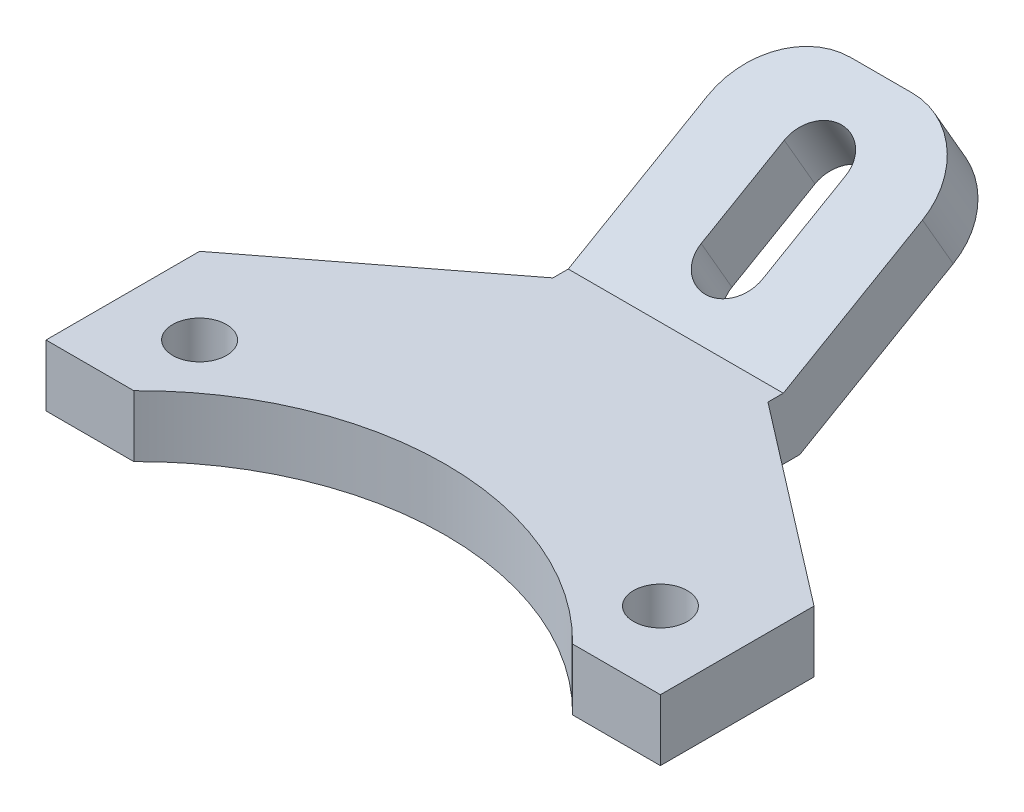
from build123d import *

# Parameters (mm, degrees)
SKETCH1_R                = 1.75
BOSS_EXTRUDE1_DEPTH      = 4
BOSS_EXTRUDE2_DEPTH      = 4
BOSS_EXTRUDE2_DEPTH_BACK = 12
SKETCH4_W                = 14
SKETCH4_H                = 4
SKETCH5_W                = 16
SKETCH5_H                = 3.464101615
CUT_EXTRUDE1_DEPTH       = 14
CUT_EXTRUDE2_DEPTH       = 14
FILLET1_R                = 5


with BuildPart() as part:
    # Sketch1 → Boss-Extrude1 (new body)
    with BuildSketch(Plane(origin=(0, 0, 0), x_dir=(1, 0, 0), z_dir=(0, 1, 0))):
        with BuildLine():
            Line((40, 10), (27, 20))
            Line((27, 20), (27, 25))
            Line((27, 25), (13, 25))
            Line((13, 25), (13, 20))
            Line((13, 20), (0, 10))
            Line((0, 10), (0, 0))
            Line((0, 0), (5.717143143, 0))
            ThreePointArc((5.717143143, 0), (20, 6), (34.282856857, 0))
            Line((34.282856857, 0), (40, 0))
            Line((40, 0), (40, 10))
        make_face()
        with Locations((5, 5)):
            Circle(SKETCH1_R, mode=Mode.SUBTRACT)
        with Locations((35, 5)):
            Circle(SKETCH1_R, mode=Mode.SUBTRACT)
    extrude(amount=BOSS_EXTRUDE1_DEPTH)

    # Sketch4 → Boss-Extrude2 (add, two sides: drawn at the far end of the back side and taken through both)
    with BuildSketch(Plane(origin=(0, 11.825317547, -20.482050808), x_dir=(1, 0, 0), z_dir=(0, -0.5000000000000041, 0.8660254037844364)).offset(-BOSS_EXTRUDE2_DEPTH_BACK)):
        with Locations((20, -9.035898385)):
            Rectangle(SKETCH4_W, SKETCH4_H)
    extrude(amount=BOSS_EXTRUDE2_DEPTH + BOSS_EXTRUDE2_DEPTH_BACK)

    # Sketch5 → Cut-Extrude1 (cut)
    with BuildSketch(Plane(origin=(0, 11.825317547, -20.482050808), x_dir=(1, 0, 0), z_dir=(0, -0.5000000000000041, 0.8660254037844364))):
        with Locations((21, -12.767949193)):
            Rectangle(SKETCH5_W, SKETCH5_H)
    extrude(amount=CUT_EXTRUDE1_DEPTH, mode=Mode.SUBTRACT)

    # Sketch6 → Cut-Extrude2 (cut)
    with BuildSketch(Plane(origin=(0, -6.09326674, -3.517949192), x_dir=(1, 0, 0), z_dir=(0, 0.8660254037844364, 0.5000000000000041))):
        with BuildLine():
            Line((18, 24.407537572), (18, 30.650635095))
            ThreePointArc((18, 30.650635095), (20, 32.650635095), (22, 30.650635095))
            Line((22, 30.650635095), (22, 24.407537572))
            ThreePointArc((22, 24.407537572), (20, 22.407537572), (18, 24.407537572))
        make_face()
    extrude(amount=-CUT_EXTRUDE2_DEPTH, mode=Mode.SUBTRACT)

    # Fillet1
    fillet1_edges = [part.edges().sort_by_distance(p)[0] for p in [
        (13, 10, -35.392304845),
        (27, 10, -35.392304845),
    ]]
    fillet(fillet1_edges, radius=FILLET1_R)


solid = part.part
